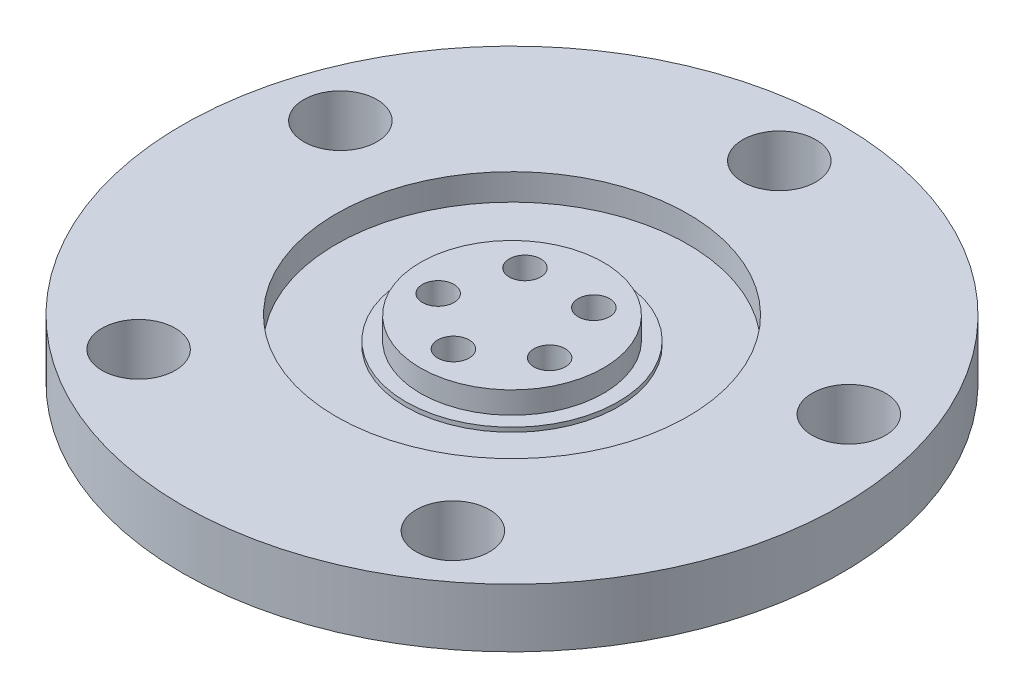
from build123d import *

# Parameters (mm, degrees)
SKETCH1_R                  = 45
SKETCH1_R_2                = 5
BOSS_EXTRUDE1_DEPTH        = 8
F_4_3_4_3_DIAMETER_HOLE1_D = 4.3
SKETCH6_R                  = 30.1
SKETCH6_R_2                = 19.9
CUT_EXTRUDE2_DEPTH         = 1.5
SKETCH8_R                  = 24
SKETCH8_R_2                = 12.5
CUT_EXTRUDE3_DEPTH         = 3
SKETCH9_R                  = 24
SKETCH9_R_2                = 14.5
CUT_EXTRUDE4_DEPTH         = 0.6


with BuildPart() as part:
    # Sketch1 → Boss-Extrude1 (new body)
    with BuildSketch(Plane(origin=(0, 0, 0), x_dir=(1, 0, 0), z_dir=(0, 1, 0))):
        with Locations(Location((0, 0, 0), (0, 0, 270))):
            Circle(SKETCH1_R)
        with Locations(Location((0, 36.5, 0), (0, 0, 270))):
            Circle(SKETCH1_R_2, mode=Mode.SUBTRACT)
        with Locations(Location((34.713562845, 11.279120295, 0), (0, 0, 270))):
            Circle(SKETCH1_R_2, mode=Mode.SUBTRACT)
        with Locations(Location((21.454161709, -29.529120295, 0), (0, 0, 270))):
            Circle(SKETCH1_R_2, mode=Mode.SUBTRACT)
        with Locations(Location((-21.454161709, -29.529120295, 0), (0, 0, 270))):
            Circle(SKETCH1_R_2, mode=Mode.SUBTRACT)
        with Locations(Location((-34.713562845, 11.279120295, 0), (0, 0, 270))):
            Circle(SKETCH1_R_2, mode=Mode.SUBTRACT)
    extrude(amount=BOSS_EXTRUDE1_DEPTH)

    # Ø4.3 (4.3) Diameter Hole1 (through all)
    with Locations(Plane(origin=(0, 8, 0), x_dir=(1, 0, 0), z_dir=(0, 1, 0))):
        with Locations((-7.60845213, -2.472135955), (-4.702282018, 6.472135955), (4.702282018, 6.472135955), (7.60845213, -2.472135955), (0, -8)):
            Hole(F_4_3_4_3_DIAMETER_HOLE1_D / 2)

    # Sketch6 → Cut-Extrude2 (cut)
    with BuildSketch(Plane.XZ):
        with Locations(Location((0, 0, 0), (0, 0, 270))):
            Circle(SKETCH6_R)
        with Locations(Location((0, 0, 0), (0, 0, 270))):
            Circle(SKETCH6_R_2, mode=Mode.SUBTRACT)
    extrude(amount=-CUT_EXTRUDE2_DEPTH, mode=Mode.SUBTRACT)

    # Sketch8 → Cut-Extrude3 (cut)
    with BuildSketch(Plane(origin=(0, 8, 0), x_dir=(1, 0, 0), z_dir=(0, 1, 0))):
        with Locations(Location((0, 0, 0), (0, 0, 270))):
            Circle(SKETCH8_R)
        with Locations(Location((0, 0, 0), (0, 0, 270))):
            Circle(SKETCH8_R_2, mode=Mode.SUBTRACT)
    extrude(amount=-CUT_EXTRUDE3_DEPTH, mode=Mode.SUBTRACT)

    # Sketch9 → Cut-Extrude4 (cut)
    with BuildSketch(Plane(origin=(0, 5, 0), x_dir=(1, 0, 0), z_dir=(0, 1, 0))):
        with Locations(Location((0, 0, 0), (0, 0, 270))):
            Circle(SKETCH9_R)
        with Locations(Location((0, 0, 0), (0, 0, 270))):
            Circle(SKETCH9_R_2, mode=Mode.SUBTRACT)
    extrude(amount=-CUT_EXTRUDE4_DEPTH, mode=Mode.SUBTRACT)


solid = part.part
